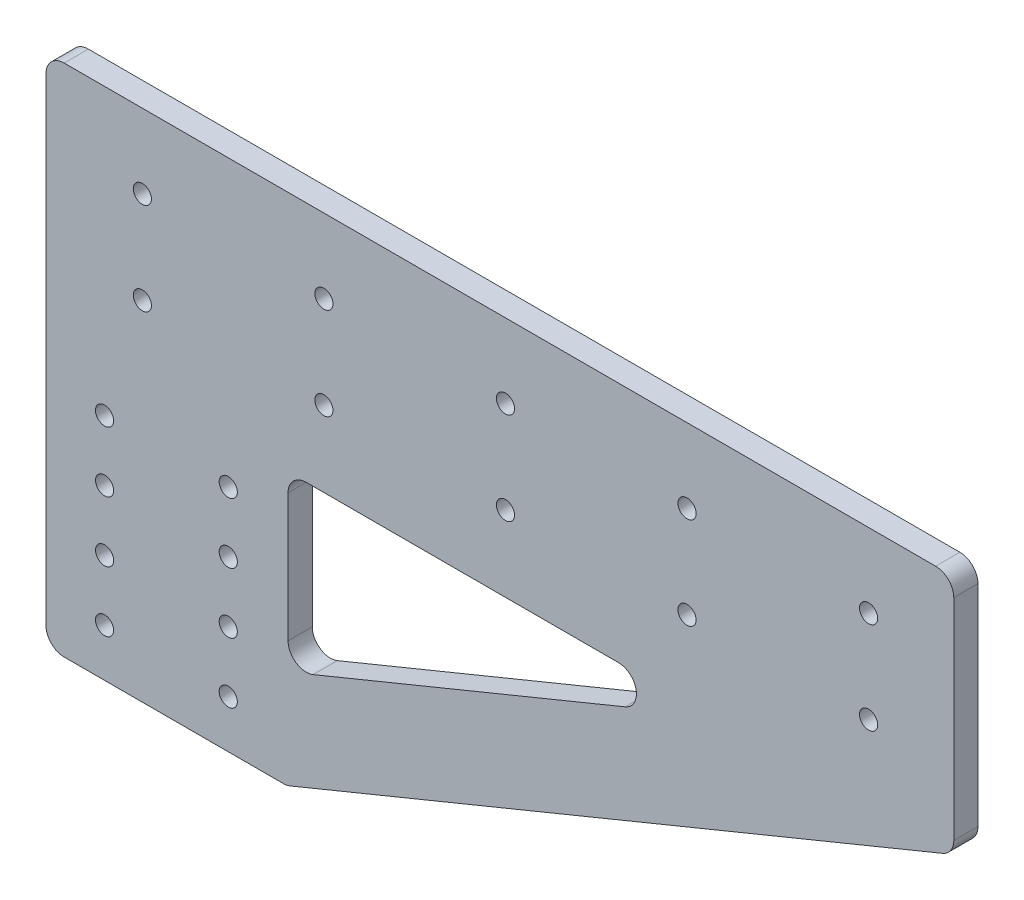
from build123d import *

# Parameters (mm, degrees)
SKETCH_1_W          = 150
SKETCH_1_H          = 85
EXTRUDE_1_DEPTH     = 4
CUT_EXTRUDE_1_DEPTH = 10
SKETCH_3_R          = 1.5
CUT_EXTRUDE_2_DEPTH = 10
CUT_EXTRUDE_3_DEPTH = 10
FILLET_1_R          = 3


with BuildPart() as part:
    # 草图1 → 凸台-拉伸1 (new body)
    with BuildSketch(Plane.XY):
        Rectangle(SKETCH_1_W, SKETCH_1_H)
    extrude(amount=EXTRUDE_1_DEPTH)

    # 草图2 → 切除-拉伸1 (cut)
    with BuildSketch(Plane(origin=(0, 0, 0), x_dir=(-1, 0, 0), z_dir=(0, 0, -1))):
        Polygon((35.204977583, -42.5), (-75, 2.740355619), (-77.497943244, -0.131283493), (-84.390465543, -55.505754288), (-64.834396177, -59.115887647), align=None)
    extrude(amount=-CUT_EXTRUDE_1_DEPTH, mode=Mode.SUBTRACT)

    # 草图3 → 切除-拉伸2 (cut)
    with BuildSketch(Plane(origin=(0, 0, 0), x_dir=(-1, 0, 0), z_dir=(0, 0, -1))):
        with Locations((-60.921137183, 30.235756338)):
            Circle(SKETCH_3_R)
        with Locations((-30.921137183, 30.235756338)):
            Circle(SKETCH_3_R)
        with Locations((-0.921137183, 30.235756338)):
            Circle(SKETCH_3_R)
        with Locations((29.078862817, 30.235756338)):
            Circle(SKETCH_3_R)
        with Locations((59.078862817, 30.235756338)):
            Circle(SKETCH_3_R)
        with Locations((59.078862817, 15.004599281)):
            Circle(SKETCH_3_R)
        with Locations((29.078862817, 15.004599281)):
            Circle(SKETCH_3_R)
        with Locations((-0.921137183, 15.004599281)):
            Circle(SKETCH_3_R)
        with Locations((-30.921137183, 15.004599281)):
            Circle(SKETCH_3_R)
        with Locations((-60.921137183, 15.004599281)):
            Circle(SKETCH_3_R)
        with Locations((44.883757424, -4.600166374)):
            Circle(SKETCH_3_R)
        with Locations((44.883757424, -14.600166374)):
            Circle(SKETCH_3_R)
        with Locations((44.883757424, -24.600166374)):
            Circle(SKETCH_3_R)
        with Locations((44.883757424, -34.600166374)):
            Circle(SKETCH_3_R)
        with Locations((65.321220159, -34.600166374)):
            Circle(SKETCH_3_R)
        with Locations((65.321220159, -24.600166374)):
            Circle(SKETCH_3_R)
        with Locations((65.321220159, -14.600166374)):
            Circle(SKETCH_3_R)
        with Locations((65.321220159, -4.600166374)):
            Circle(SKETCH_3_R)
    extrude(amount=-CUT_EXTRUDE_2_DEPTH, mode=Mode.SUBTRACT)

    # 草图4 → 切除-拉伸3 (cut)
    with BuildSketch(Plane(origin=(0, 0, 0), x_dir=(-1, 0, 0), z_dir=(0, 0, -1))):
        Polygon((-34.771828022, 2.5), (35, -26.142102935), (35, 2.5), align=None)
    extrude(amount=-CUT_EXTRUDE_3_DEPTH, mode=Mode.SUBTRACT)

    # 圆角1
    fillet_1_edges = [part.edges().sort_by_distance(p)[0] for p in [
        (34.771828022, 2.5, 2),
        (-35, 2.5, 2),
        (-35, -26.142102935, 2),
        (75, 2.740355619, 2),
        (-35.204977583, -42.5, 2),
        (-75, -42.5, 2),
        (-75, 42.5, 2),
        (75, 42.5, 2),
    ]]
    fillet(fillet_1_edges, radius=FILLET_1_R)


solid = part.part
